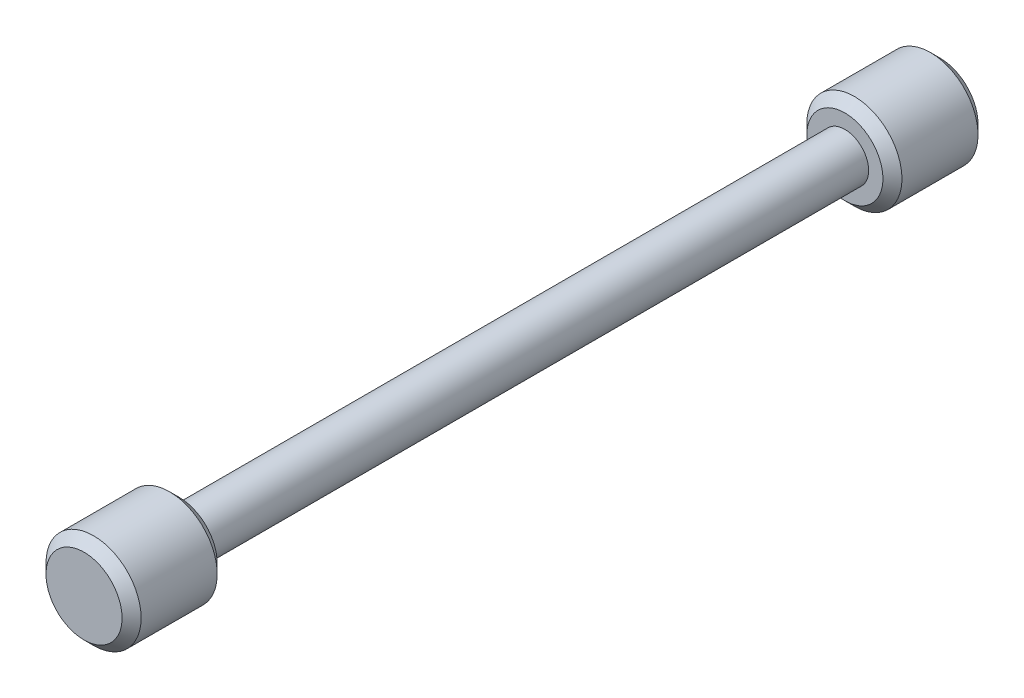
from build123d import *

# Parameters (mm, degrees)
CHAMFER1_SIZE = 1.27


with BuildPart() as part:
    # Sketch1 → Revolve1 (revolve)
    with BuildSketch(Plane(origin=(0, 0, 0), x_dir=(0, 0, -1), z_dir=(1, 0, 0))):
        Polygon((-44.45, 0), (44.45, 0), (44.45, 3.175), (57.15, 3.175), (57.15, -3.175), (-57.15, -3.175), (-57.15, 3.175), (-44.45, 3.175), align=None)
    revolve(axis=Axis((0, -3.175, -57.15), (0, 0, 1)))

    # Chamfer1
    chamfer1_edges = [part.edges().sort_by_distance(p)[0] for p in [
        (0, -9.525, 44.45),
        (0, -9.525, 57.15),
        (0, -9.525, -57.15),
        (0, -9.525, -44.45),
    ]]
    chamfer(chamfer1_edges, length=CHAMFER1_SIZE)


solid = part.part
